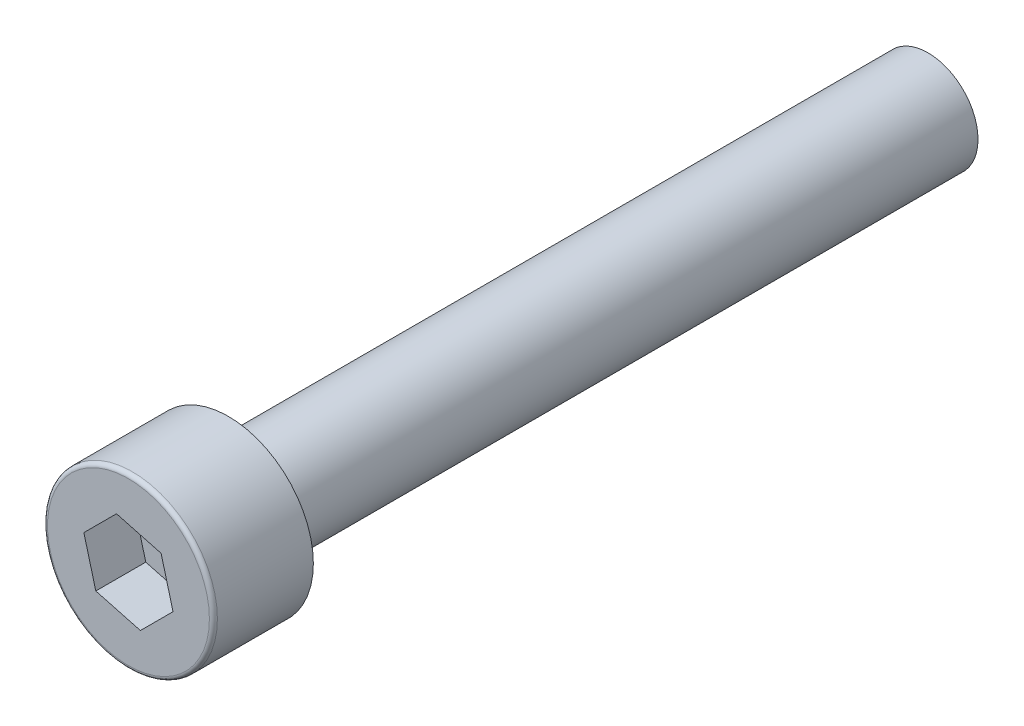
from build123d import *

# Parameters (mm, degrees)
SKETCH_1_R          = 4.25
EXTRUDE_1_DEPTH     = 5
CUT_EXTRUDE_1_DEPTH = 2.5
SKETCH_3_R          = 2.5
EXTRUDE_2_DEPTH     = 35
FILLET_1_R          = 0.2


with BuildPart() as part:
    # 草图1 → 凸台-拉伸1 (new body)
    with BuildSketch(Plane.XY):
        Circle(SKETCH_1_R)
    extrude(amount=EXTRUDE_1_DEPTH)

    # 草图2 → 切除-拉伸1 (cut)
    with BuildSketch(Plane.XY.offset(5)):
        Polygon((-1.632993162, -1.632993162), (0.597716981, -2.230710143), (2.230710143, -0.597716981), (1.632993162, 1.632993162), (-0.597716981, 2.230710143), (-2.230710143, 0.597716981), align=None)
    extrude(amount=-CUT_EXTRUDE_1_DEPTH, mode=Mode.SUBTRACT)

    # 草图3 → 凸台-拉伸2 (add)
    with BuildSketch(Plane(origin=(0, 0, 0), x_dir=(-1, 0, 0), z_dir=(0, 0, -1))):
        with Locations(Location((0, 0, 0), (0, 0, 180))):
            Circle(SKETCH_3_R)
    extrude(amount=EXTRUDE_2_DEPTH)

    # 圆角1
    fillet_1_edges = [part.edges().sort_by_distance(p)[0] for p in [
        (-4.25, 0, 5),
    ]]
    fillet(fillet_1_edges, radius=FILLET_1_R)


solid = part.part
